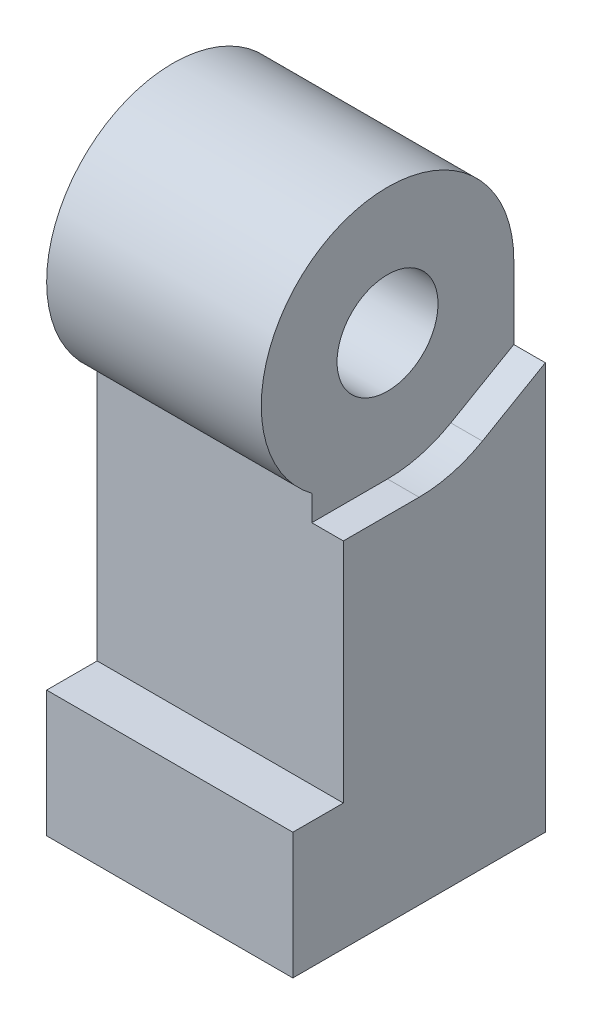
from build123d import *

# Parameters (mm, degrees)
SKETCH1_W                                      = 10
SKETCH1_H                                      = 10
FOOT_DEPTH                                     = 5
SKETCH2_W                                      = 10
SKETCH2_H                                      = 8
LEG_DEPTH                                      = 14
SKETCH3_R                                      = 5
HIP_CONNECTOR_DEPTH                            = 10
SKETCH20_R                                     = 3.5
DECORATIVE_CIRCLE_THAT_MAKES_THIS_EASY_T_DEPTH = 0.1
HIP_ROOM_DEPTH                                 = 1.5
HIP_HOLE_D                                     = 4
HIP_HOLE_DEPTH                                 = 6
HIP_HOLE_TIP                                   = 1.201721238
SKETCH18_W                                     = 6
SKETCH18_H                                     = 6
FOOT_HOLE_DEPTH                                = 2.5
WEIGHT_REDUCTION_MAKE_IT_EASY_TO_ADD_CEN_D     = 3
WEIGHT_REDUCTION_MAKE_IT_EASY_TO_ADD_CEN_DEPTH = 8
WEIGHT_REDUCTION_MAKE_IT_EASY_TO_ADD_CEN_TIP   = 0.901290929
SKETCH19_W                                     = 10
SKETCH19_H                                     = 20
THIGH_GAP_DEPTH                                = 0.25
SCALE1_SCALE                                   = 2


with BuildPart() as part:
    # Sketch1 → Foot (new body)
    with BuildSketch(Plane(origin=(0, 0, 0), x_dir=(1, 0, 0), z_dir=(0, 1, 0))):
        with Locations((5, -5)):
            Rectangle(SKETCH1_W, SKETCH1_H)
    extrude(amount=FOOT_DEPTH)

    # Sketch2 → Leg (add)
    with BuildSketch(Plane(origin=(0, 5, 0), x_dir=(1, 0, 0), z_dir=(0, 1, 0))):
        with Locations((5, -4)):
            Rectangle(SKETCH2_W, SKETCH2_H)
    extrude(amount=LEG_DEPTH)

    # Sketch3 → Hip Connector (add)
    with BuildSketch(Plane(origin=(0, 0, 0), x_dir=(0, 0, -1), z_dir=(1, 0, 0))):
        with Locations((-5, 19)):
            Circle(SKETCH3_R)
    extrude(amount=HIP_CONNECTOR_DEPTH)

    # Sketch20 → Decorative circle that makes this easy to dimension (cut)
    with BuildSketch(Plane.ZY):
        with Locations((5, 19)):
            Circle(SKETCH20_R)
    extrude(amount=-DECORATIVE_CIRCLE_THAT_MAKES_THIS_EASY_T_DEPTH, mode=Mode.SUBTRACT)

    # Sketch4 → Hip room (cut)
    with BuildSketch(Plane(origin=(10, 0, 0), x_dir=(0, 0, -1), z_dir=(1, 0, 0))):
        with BuildLine():
            Line((-5, 13.99), (-10, 13.99))
            Line((-10, 13.99), (-10, 24))
            Line((-10, 24), (0, 24))
            Line((0, 24), (0, 16.101701649))
            Line((0, 16.101701649), (-2.495, 14.661212727))
            ThreePointArc((-2.495, 14.661212727), (-3.703316584, 14.16071161), (-5, 13.99))
        make_face()
    extrude(amount=-HIP_ROOM_DEPTH, mode=Mode.SUBTRACT)

    # Hip hole
    with Locations(Plane(origin=(8.5, 0, 0), x_dir=(0, 0, -1), z_dir=(1, 0, 0))):
        with Locations((-5, 19)):
            Hole(HIP_HOLE_D / 2, depth=HIP_HOLE_DEPTH)
            with Locations((0, 0, -(HIP_HOLE_DEPTH + HIP_HOLE_TIP / 2))):  # 118° drill point
                Cone(0, HIP_HOLE_D / 2, HIP_HOLE_TIP, mode=Mode.SUBTRACT)

    # Sketch18 → Foot hole (cut)
    with BuildSketch(Plane.XZ):
        with Locations((5, 5)):
            Rectangle(SKETCH18_W, SKETCH18_H)
    extrude(amount=-FOOT_HOLE_DEPTH, mode=Mode.SUBTRACT)

    # Weight reduction/make it easy to add centerline hole
    with Locations(Plane(origin=(0, 2.5, 0), x_dir=(-1, 0, 0), z_dir=(0, -1, 0))):
        with Locations((-5, -5)):
            Hole(WEIGHT_REDUCTION_MAKE_IT_EASY_TO_ADD_CEN_D / 2, depth=WEIGHT_REDUCTION_MAKE_IT_EASY_TO_ADD_CEN_DEPTH)
            with Locations((0, 0, -(WEIGHT_REDUCTION_MAKE_IT_EASY_TO_ADD_CEN_DEPTH + WEIGHT_REDUCTION_MAKE_IT_EASY_TO_ADD_CEN_TIP / 2))):  # 118° drill point
                Cone(0, WEIGHT_REDUCTION_MAKE_IT_EASY_TO_ADD_CEN_D / 2, WEIGHT_REDUCTION_MAKE_IT_EASY_TO_ADD_CEN_TIP, mode=Mode.SUBTRACT)

    # Sketch19 → Thigh gap (cut)
    with BuildSketch(Plane(origin=(10, 0, 0), x_dir=(0, 0, -1), z_dir=(1, 0, 0))):
        with Locations((-5, 10)):
            Rectangle(SKETCH19_W, SKETCH19_H)
    extrude(amount=-THIGH_GAP_DEPTH, mode=Mode.SUBTRACT)


with BuildPart() as part_1:
    # Scale1: scaled about (4.599513464, 11.496150449, 4.477610723)
    add(part.part.scale(SCALE1_SCALE).moved(Location((-4.599513464, -11.496150449, -4.477610723))))


solid = part_1.part
